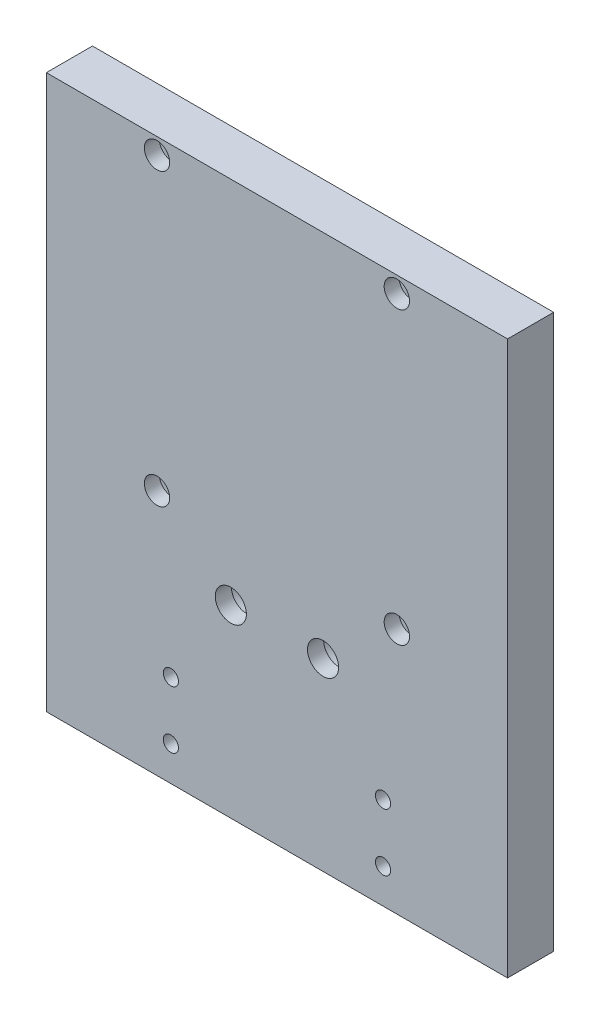
from build123d import *

# Parameters (mm, degrees)
SKETCH1_W                = 240
SKETCH1_H                = 240
BOSS_EXTRUDE1_DEPTH      = 20
CUT_EXTRUDE1_DEPTH       = 210.045449604
CUT_EXTRUDE1_DEPTH_BACK  = 210.045449604
SKETCH2_R                = 3.3
SKETCH3_R                = 5.5
CUT_EXTRUDE3_DEPTH       = 6.5
CUT_EXTRUDE4_DEPTH       = 210.045449604
CUT_EXTRUDE4_DEPTH_BACK  = 210.045449604
SKETCH4_R                = 6.75
SKETCH5_R                = 10
CUT_EXTRUDE6_DEPTH       = 13
CUT_EXTRUDE7_DEPTH       = 210.045449604
CUT_EXTRUDE7_DEPTH_BACK  = 210.045449604
SKETCH6_R                = 3.3
SKETCH7_R                = 5.5
CUT_EXTRUDE9_DEPTH       = 6.5
CUT_EXTRUDE10_DEPTH      = 210.045449604
CUT_EXTRUDE10_DEPTH_BACK = 210.045449604
SKETCH8_W                = 30
SKETCH8_H                = 260


with BuildPart() as part:
    # Sketch1 → Boss-Extrude1 (new body)
    with BuildSketch(Plane.XY):
        with Locations((0, -50)):
            Rectangle(SKETCH1_W, SKETCH1_H)
    extrude(amount=BOSS_EXTRUDE1_DEPTH)

    # Sketch2 → Cut-Extrude1 (cut, two sides: drawn at the far end of the back side and taken through both)
    with BuildSketch(Plane.XY.offset(-CUT_EXTRUDE1_DEPTH_BACK)):
        with Locations((-52, -63)):
            Circle(SKETCH2_R)
        with Locations((-52, 63)):
            Circle(SKETCH2_R)
        with Locations((52, -63)):
            Circle(SKETCH2_R)
        with Locations((52, 63)):
            Circle(SKETCH2_R)
    extrude(amount=CUT_EXTRUDE1_DEPTH + CUT_EXTRUDE1_DEPTH_BACK, mode=Mode.SUBTRACT)

    # Sketch3 → Cut-Extrude3 (cut)
    with BuildSketch(Plane.XY.offset(20)):
        with Locations((-52, -63)):
            Circle(SKETCH3_R)
        with Locations((-52, 63)):
            Circle(SKETCH3_R)
        with Locations((52, -63)):
            Circle(SKETCH3_R)
        with Locations((52, 63)):
            Circle(SKETCH3_R)
    extrude(amount=-CUT_EXTRUDE3_DEPTH, mode=Mode.SUBTRACT)

    # Sketch4 → Cut-Extrude4 (cut, two sides: drawn at the far end of the back side and taken through both)
    with BuildSketch(Plane.XY.offset(-CUT_EXTRUDE4_DEPTH_BACK)):
        with Locations((-20, -90)):
            Circle(SKETCH4_R)
        with Locations((20, -90)):
            Circle(SKETCH4_R)
    extrude(amount=CUT_EXTRUDE4_DEPTH + CUT_EXTRUDE4_DEPTH_BACK, mode=Mode.SUBTRACT)

    # Sketch5 → Cut-Extrude6 (cut)
    with BuildSketch(Plane.XY):
        with Locations((-20, -90)):
            Circle(SKETCH5_R)
        with Locations((20, -90)):
            Circle(SKETCH5_R)
    extrude(amount=CUT_EXTRUDE6_DEPTH, mode=Mode.SUBTRACT)

    # Sketch6 → Cut-Extrude7 (cut, two sides: drawn at the far end of the back side and taken through both)
    with BuildSketch(Plane.XY.offset(-CUT_EXTRUDE7_DEPTH_BACK)):
        with Locations((-46, -130)):
            Circle(SKETCH6_R)
        with Locations((-46, -155)):
            Circle(SKETCH6_R)
        with Locations((46, -130)):
            Circle(SKETCH6_R)
        with Locations((46, -155)):
            Circle(SKETCH6_R)
    extrude(amount=CUT_EXTRUDE7_DEPTH + CUT_EXTRUDE7_DEPTH_BACK, mode=Mode.SUBTRACT)

    # Sketch7 → Cut-Extrude9 (cut)
    with BuildSketch(Plane.XY):
        with Locations((-46, -130)):
            Circle(SKETCH7_R)
        with Locations((-46, -155)):
            Circle(SKETCH7_R)
        with Locations((46, -130)):
            Circle(SKETCH7_R)
        with Locations((46, -155)):
            Circle(SKETCH7_R)
    extrude(amount=CUT_EXTRUDE9_DEPTH, mode=Mode.SUBTRACT)

    # Sketch8 → Cut-Extrude10 (cut, two sides: drawn at the far end of the back side and taken through both)
    with BuildSketch(Plane.XY.offset(-CUT_EXTRUDE10_DEPTH_BACK)):
        with Locations((-115, -50)):
            Rectangle(SKETCH8_W, SKETCH8_H)
        with Locations((115, -50)):
            Rectangle(SKETCH8_W, SKETCH8_H)
    extrude(amount=CUT_EXTRUDE10_DEPTH + CUT_EXTRUDE10_DEPTH_BACK, mode=Mode.SUBTRACT)


solid = part.part
